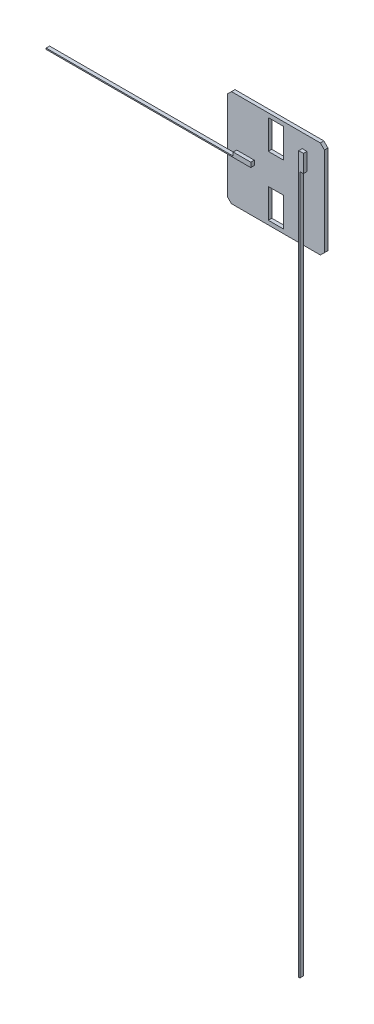
from build123d import *

# Parameters (mm, degrees)
SKETCH1_W           = 83
SKETCH1_H           = 83
BOSS_EXTRUDE1_DEPTH = 3
SKETCH2_W           = 13
SKETCH2_H           = 25
CUT_EXTRUDE1_DEPTH  = 3
CHAMFER1_SIZE       = 3.5
SKETCH3_W           = 15
SKETCH3_H           = 3
SKETCH3_W_2         = 3
SKETCH3_H_2         = 15
BOSS_EXTRUDE2_DEPTH = 3
SKETCH4_W           = 3
SKETCH4_H           = 612
BOSS_EXTRUDE3_DEPTH = 1
SKETCH5_W           = 175
SKETCH5_H           = 3
BOSS_EXTRUDE4_DEPTH = 1


with BuildPart() as part:
    # Sketch1 → Boss-Extrude1 (new body)
    with BuildSketch(Plane.XY):
        Rectangle(SKETCH1_W, SKETCH1_H)
    extrude(amount=BOSS_EXTRUDE1_DEPTH)

    # Sketch2 → Cut-Extrude1 (cut)
    with BuildSketch(Plane.XY.offset(3)):
        with Locations((0, 25.5)):
            Rectangle(SKETCH2_W, SKETCH2_H)
        with Locations((0, -25.5)):
            Rectangle(SKETCH2_W, SKETCH2_H)
    extrude(amount=-CUT_EXTRUDE1_DEPTH, mode=Mode.SUBTRACT)

    # Chamfer1
    chamfer1_edges = [part.edges().sort_by_distance(p)[0] for p in [
        (-41.5, 41.5, 1.5),
        (41.5, 41.5, 1.5),
        (41.5, -41.5, 1.5),
        (-41.5, -41.5, 1.5),
    ]]
    chamfer(chamfer1_edges, length=CHAMFER1_SIZE)

    # Sketch3 → Boss-Extrude2 (add)
    with BuildSketch(Plane.XY.offset(3)):
        with Locations((-26, -1)):
            Rectangle(SKETCH3_W, SKETCH3_H)
        with Locations((25, 22)):
            Rectangle(SKETCH3_W_2, SKETCH3_H_2)
    extrude(amount=BOSS_EXTRUDE2_DEPTH)

    # Sketch4 → Boss-Extrude3 (add)
    with BuildSketch(Plane.ZY.offset(-23.5)):
        with Locations((4.5, -276.5)):
            Rectangle(SKETCH4_W, SKETCH4_H)
    extrude(amount=BOSS_EXTRUDE3_DEPTH)

    # Sketch5 → Boss-Extrude4 (add)
    with BuildSketch(Plane.XZ.offset(2.5)):
        with Locations((-106, 4.5)):
            Rectangle(SKETCH5_W, SKETCH5_H)
    extrude(amount=BOSS_EXTRUDE4_DEPTH)


solid = part.part
